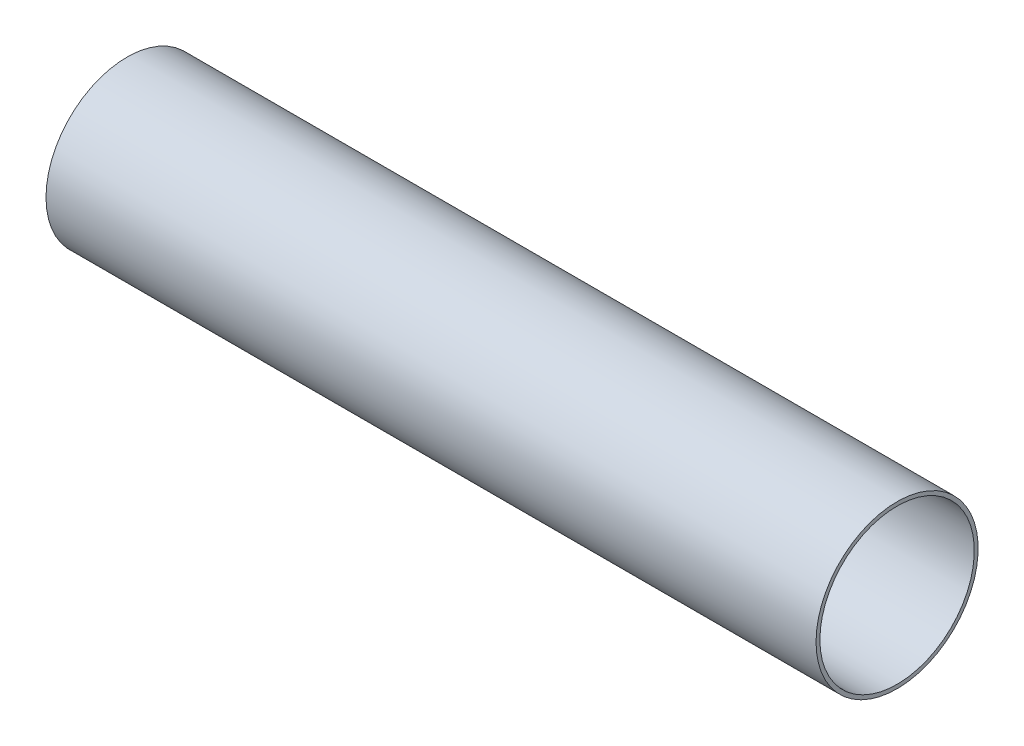
from build123d import *

# Parameters (mm, degrees)
SKETCH1_R           = 101.6
SKETCH1_R_2         = 96.774
BOSS_EXTRUDE1_DEPTH = 965.2


with BuildPart() as part:
    # Sketch1 → Boss-Extrude1 (new body)
    with BuildSketch(Plane(origin=(0, 0, 0), x_dir=(0, 0, -1), z_dir=(1, 0, 0))):
        with Locations(Location((0, 0, 0), (0, 0, 180))):
            Circle(SKETCH1_R)
        with Locations(Location((0, 0, 0), (0, 0, 180))):
            Circle(SKETCH1_R_2, mode=Mode.SUBTRACT)
    extrude(amount=BOSS_EXTRUDE1_DEPTH)


solid = part.part
